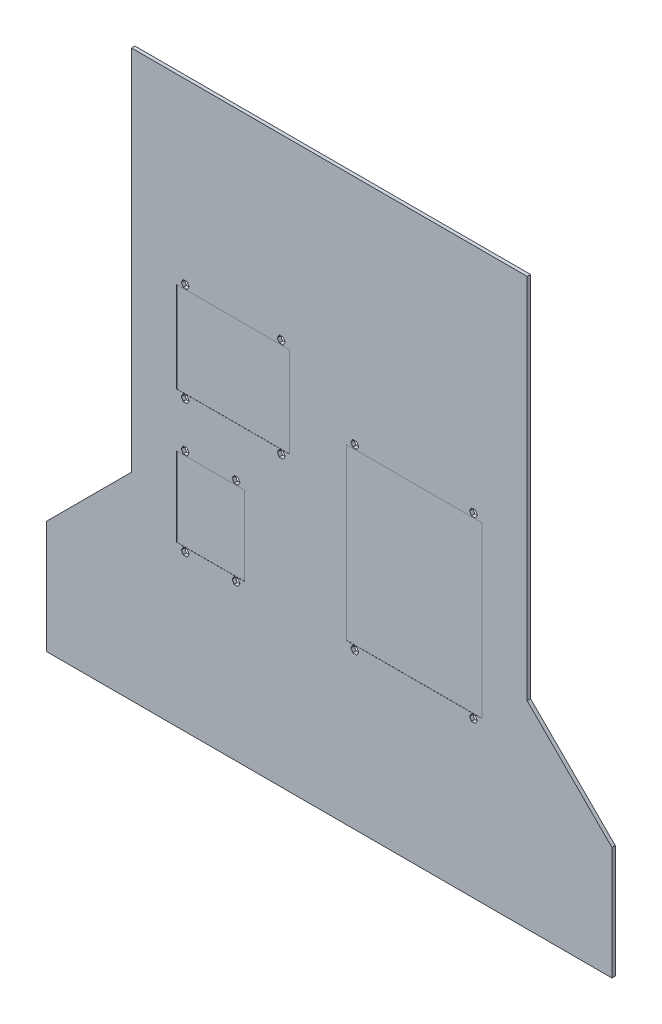
from build123d import *

# Parameters (mm, degrees)
BOSS_EXTRUDE1_DEPTH = 3
CUT_EXTRUDE3_START  = 3
SKETCH3_W           = 100
SKETCH3_H           = 80
SKETCH3_W_2         = 120
SKETCH3_H_2         = 150
SKETCH3_W_3         = 60
SKETCH3_H_3         = 70
CUT_EXTRUDE3_DEPTH  = 0.1
CUT_EXTRUDE4_DEPTH  = 560.025044162


with BuildPart() as part:
    # Sketch1 → Boss-Extrude1 (new body)
    with BuildSketch(Plane.XY):
        Polygon((-250, 0), (-250, 100), (-175, 175), (-175, 500), (175, 500), (175, 175), (250, 100), (250, 0), align=None)
    extrude(amount=BOSS_EXTRUDE1_DEPTH)

    # Sketch3 → Cut-Extrude3 (cut)
    with BuildSketch(Plane.XY.offset(CUT_EXTRUDE3_START)):
        with Locations((-85, 298.75)):
            Rectangle(SKETCH3_W, SKETCH3_H)
        with Locations((75, 216.25)):
            Rectangle(SKETCH3_W_2, SKETCH3_H_2)
        with Locations((-105, 176.25)):
            Rectangle(SKETCH3_W_3, SKETCH3_H_3)
    extrude(amount=-CUT_EXTRUDE3_DEPTH, mode=Mode.SUBTRACT)

    # Sketch4 → Cut-Extrude4 (cut, through all)
    with BuildSketch(Plane(origin=(0, 0, 0), x_dir=(-1, 0, 0), z_dir=(0, 0, -1))):
        Polygon((-20.767949192, 140.5), (-24.232050808, 140.5), (-25.964101615, 137.5), (-24.232050808, 134.5), (-20.767949192, 134.5), (-19.035898385, 137.5), align=None)
        Polygon((-129.232050808, 134.5), (-125.767949192, 134.5), (-124.035898385, 137.5), (-125.767949192, 140.5), (-129.232050808, 140.5), (-130.964101615, 137.5), align=None)
        Polygon((79.035898385, 137.5), (80.767949192, 134.5), (84.232050808, 134.5), (85.964101615, 137.5), (84.232050808, 140.5), (80.767949192, 140.5), align=None)
        Polygon((129.232050808, 134.5), (130.964101615, 137.5), (129.232050808, 140.5), (125.767949192, 140.5), (124.035898385, 137.5), (125.767949192, 134.5), align=None)
        Polygon((129.232050808, 218), (125.767949192, 218), (124.035898385, 215), (125.767949192, 212), (129.232050808, 212), (130.964101615, 215), align=None)
        Polygon((80.767949192, 218), (79.035898385, 215), (80.767949192, 212), (84.232050808, 212), (85.964101615, 215), (84.232050808, 218), align=None)
        Polygon((125.767949192, 252), (129.232050808, 252), (130.964101615, 255), (129.232050808, 258), (125.767949192, 258), (124.035898385, 255), align=None)
        Polygon((44.232050808, 252), (45.964101615, 255), (44.232050808, 258), (40.767949192, 258), (39.035898385, 255), (40.767949192, 252), align=None)
        Polygon((-130.964101615, 295), (-129.232050808, 292), (-125.767949192, 292), (-124.035898385, 295), (-125.767949192, 298), (-129.232050808, 298), align=None)
        Polygon((-19.035898385, 295), (-20.767949192, 298), (-24.232050808, 298), (-25.964101615, 295), (-24.232050808, 292), (-20.767949192, 292), align=None)
        Polygon((40.767949192, 345.5), (39.035898385, 342.5), (40.767949192, 339.5), (44.232050808, 339.5), (45.964101615, 342.5), (44.232050808, 345.5), align=None)
        Polygon((129.232050808, 345.5), (125.767949192, 345.5), (124.035898385, 342.5), (125.767949192, 339.5), (129.232050808, 339.5), (130.964101615, 342.5), align=None)
    extrude(amount=-CUT_EXTRUDE4_DEPTH, mode=Mode.SUBTRACT)


solid = part.part
